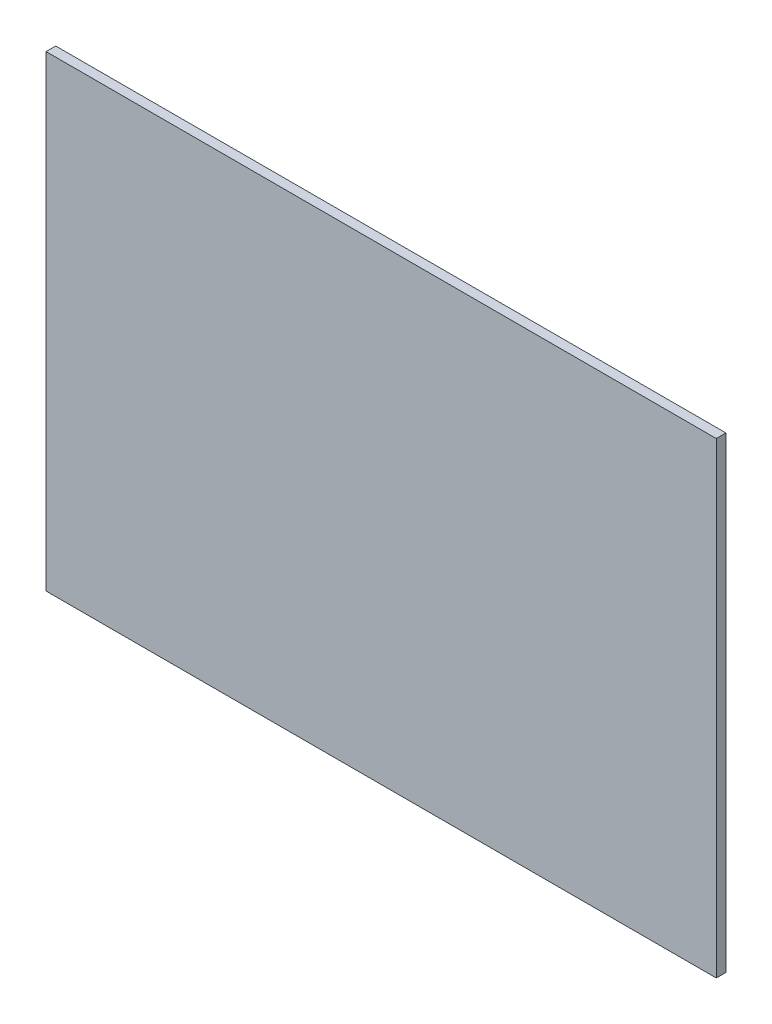
from build123d import *

# Parameters (mm, degrees)
CROQUIS1_W              = 208
CROQUIS1_H              = 145
SALIENTE_EXTRUIR1_DEPTH = 3


with BuildPart() as part:
    # Croquis1 → Saliente-Extruir1 (new body)
    with BuildSketch(Plane.XY):
        with Locations((8.43228511, 27.018527919)):
            Rectangle(CROQUIS1_W, CROQUIS1_H)
    extrude(amount=SALIENTE_EXTRUIR1_DEPTH)


solid = part.part
